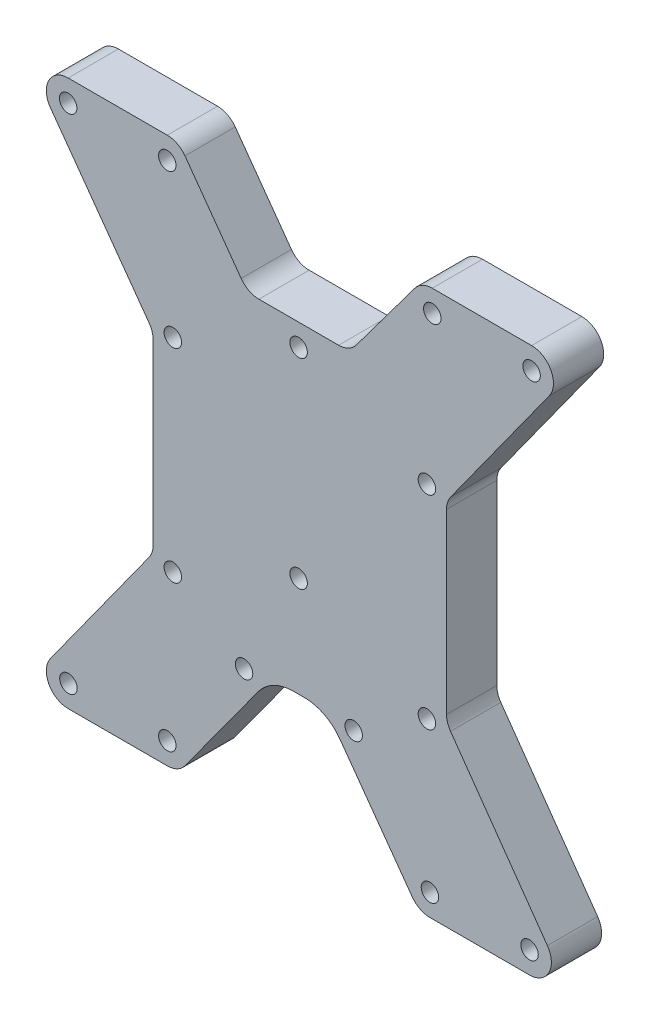
from build123d import *

# Parameters (mm, degrees)
ESQUISSE1_R             = 2
BOSS_EXTRU_1_DEPTH      = 20
BOSS_EXTRU_1_2_DEPTH    = 20
ESQUISSE1_R_2           = 1.874692251
ESQUISSE1_R_3           = 2.114769536
ESQUISSE1_R_4           = 1.974337249
ESQUISSE1_R_5           = 1.950118469
ESQUISSE1_R_6           = 2.076355312
ESQUISSE1_R_7           = 2.221970672
ESQUISSE1_R_8           = 1.90604453
BOSS_EXTRU_1_3_DEPTH    = 20
BOSS_EXTRU_2_DEPTH      = 3
ENL_V_START             = -3
ESQUISSE3_R             = 2
ESQUISSE3_R_2           = 1.90604453
ESQUISSE3_R_3           = 1.874692251
ESQUISSE3_R_4           = 2.114769536
ESQUISSE3_R_5           = 2.076355312
ESQUISSE3_R_6           = 2.221970672
ESQUISSE3_R_7           = 1.950118469
ESQUISSE3_R_8           = 1.974337249
ENL_V_MAT_EXTRU_1_DEPTH = 3
ESQUISSE5_R             = 4
ENL_V_MAT_EXTRU_2_DEPTH = 15
BOSS_EXTRU_6_START      = 10
BOSS_EXTRU_6_DEPTH      = 10


with BuildPart() as part:
    # Esquisse1 → Boss.-Extru.1 (new body)
    with BuildSketch(Plane.XY):
        with BuildLine():
            Line((-12.618276583, 25.9), (12.60601399, 25.9))
            ThreePointArc((12.60601399, 25.9), (8.484252591, 30.605859035), (6.074382869, 36.378774607))
            ThreePointArc((6.074382869, 36.378774607), (0, 39.9), (-6.074382869, 36.378774607))
            ThreePointArc((-6.074382869, 36.378774607), (-8.506971248, 30.615216027), (-12.618276583, 25.9))
        make_face()
        with Locations((0, 32.9)):
            Circle(ESQUISSE1_R, mode=Mode.SUBTRACT)
    extrude(amount=BOSS_EXTRU_1_DEPTH)



with BuildPart() as body_2:
    # Esquisse1 → Boss.-Extru.1 2 (new body)
    with BuildSketch(Plane.XY):
        with BuildLine():
            Line((2.654185885, -10.017862175), (-2.311787947, -10.017862175))
            ThreePointArc((-2.311787947, -10.017862175), (-3.342840598, -10.040984005), (-4.37182022, -10.110303007))
            ThreePointArc((-4.37182022, -10.110303007), (-9.899398478, -11.305465567), (-14.96824135, -13.813326584))
            ThreePointArc((-14.96824135, -13.813326584), (-17.22060215, -8.68083268), (-21.967207188, -5.7))
            Line((-21.967207188, -5.7), (-26.916713164, -5.7))
            ThreePointArc((-26.916713164, -5.7), (-33.497831038, -11.919356094), (-31.915503509, -20.834945939))
            ThreePointArc((-31.915503509, -20.834945939), (-29.076568093, -25.648377222), (-29.441804446, -31.224691186))
            Line((-29.441804446, -31.224691186), (-48.33551387, -57.219681091))
            ThreePointArc((-48.33551387, -57.219681091), (-52.350310177, -57.311139571), (-56.059284304, -55.771508132))
            ThreePointArc((-56.059284304, -55.771508132), (-63.290765435, -55.324955296), (-67.094106026, -61.491666667))
            ThreePointArc((-67.094106026, -61.491666667), (-66.815352866, -65.113322107), (-68.149848832, -68.491666667))
            Line((-68.149848832, -68.491666667), (-68.149848832, -71.491666667))
            Line((-68.149848832, -71.491666667), (-60.094106026, -71.491666667))
            ThreePointArc((-60.094106026, -71.491666667), (-55.55501347, -70.402145821), (-52.005008106, -67.37099442))
            Line((-52.005008106, -67.37099442), (-18.489983788, -21.259206667))
            ThreePointArc((-18.489983788, -21.259206667), (-12.296910299, -15.688773), (-4.37182022, -13.124238397))
            ThreePointArc((-4.37182022, -13.124238397), (-3.343176437, -13.044473935), (-2.311787947, -13.017862175))
            Line((-2.311787947, -13.017862175), (2.654185885, -13.017862175))
            ThreePointArc((2.654185885, -13.017862175), (3.767745611, -13.048886619), (4.87785058, -13.141863701))
            ThreePointArc((4.87785058, -13.141863701), (12.749204669, -15.752561837), (18.884872714, -21.331767658))
            Line((18.884872714, -21.331767658), (52.006994026, -67.334713925))
            ThreePointArc((52.006994026, -67.334713925), (55.563306435, -70.391960836), (60.122337441, -71.491666667))
            Line((60.122337441, -71.491666667), (71.236181886, -71.491666667))
            Line((71.236181886, -71.491666667), (71.236181886, -68.491666667))
            Line((71.236181886, -68.491666667), (71.09992357, -68.491666667))
            ThreePointArc((71.09992357, -68.491666667), (68.064909876, -65.586157047), (67.122337441, -61.491666667))
            ThreePointArc((67.122337441, -61.491666667), (63.633526727, -55.435962761), (56.644751785, -55.416603045))
            ThreePointArc((56.644751785, -55.416603045), (52.423917568, -56.89180534), (47.963309043, -56.584177514))
            Line((47.963309043, -56.584177514), (29.320038148, -30.690745717))
            ThreePointArc((29.320038148, -30.690745717), (30.228551236, -25.172272486), (32.84662865, -20.230146072))
            ThreePointArc((32.84662865, -20.230146072), (33.960030671, -11.490301016), (27.319475738, -5.7))
            Line((27.319475738, -5.7), (23.109581013, -5.7))
            ThreePointArc((23.109581013, -5.7), (18.088025153, -8.753702797), (15.878062286, -14.19954416))
            ThreePointArc((15.878062286, -14.19954416), (10.642043612, -11.449502735), (4.87785058, -10.125607692))
            ThreePointArc((4.87785058, -10.125607692), (3.767322643, -10.044814346), (2.654185885, -10.017862175))
        make_face()
        with Locations((-60.094106026, -61.491666667)):
            Circle(ESQUISSE1_R, mode=Mode.SUBTRACT)
        with Locations((60.122337441, -61.491666667)):
            Circle(ESQUISSE1_R, mode=Mode.SUBTRACT)
        with Locations((-24.979248711, -15.438514977)):
            Circle(ESQUISSE1_R, mode=Mode.SUBTRACT)
        with Locations((25.214528375, -14.817021081)):
            Circle(ESQUISSE1_R, mode=Mode.SUBTRACT)
    extrude(amount=BOSS_EXTRU_1_2_DEPTH)


with BuildPart() as body_3:
    # Esquisse1 → Boss.-Extru.1 3 (new body)
    with BuildSketch(Plane.XY):
        with BuildLine():
            Line((98.695206273, -68.491666667), (98.695206273, -71.491666667))
            Line((98.695206273, -71.491666667), (105.695206273, -71.491666667))
            ThreePointArc((105.695206273, -71.491666667), (114.574610374, -66.091251737), (113.86352118, -55.72290323))
            Line((113.86352118, -55.72290323), (69.552217021, 7.019951504))
            ThreePointArc((69.552217021, 7.019951504), (68.189447281, 9.762425882), (67.720531927, 12.788714941))
            Line((67.720531927, 12.788714941), (67.720531927, 94.127663598))
            ThreePointArc((67.720531927, 94.127663598), (68.203564052, 97.198058112), (69.605996421, 99.971832788))
            Line((69.605996421, 99.971832788), (114.751095568, 162.655081347))
            ThreePointArc((114.751095568, 162.655081347), (115.537169364, 173.057666276), (106.636560061, 178.499250537))
            Line((106.636560061, 178.499250537), (61.180006109, 178.499250537))
            ThreePointArc((61.180006109, 178.499250537), (56.695159764, 177.437155955), (53.162979619, 174.476481188))
            Line((53.162979619, 174.476481188), (26.339854767, 138.499669349))
            ThreePointArc((26.339854767, 138.499669349), (22.807674623, 135.538994582), (18.322828278, 134.4769))
            Line((18.322828278, 134.4769), (-18.17503056, 134.4769))
            ThreePointArc((-18.17503056, 134.4769), (-22.734061565, 135.576605831), (-26.290373974, 138.633852742))
            Line((-26.290373974, 138.633852742), (-52.006994026, 174.351380592))
            ThreePointArc((-52.006994026, 174.351380592), (-55.563306435, 177.408627502), (-60.122337441, 178.508333333))
            Line((-60.122337441, 178.508333333), (-105.477662559, 178.508333333))
            ThreePointArc((-105.477662559, 178.508333333), (-114.377956728, 173.067364339), (-113.593005974, 162.665286075))
            Line((-113.593005974, 162.665286075), (-68.454184001, 99.972477779))
            ThreePointArc((-68.454184001, 99.972477779), (-67.052347315, 97.199167143), (-66.569527415, 94.129430521))
            Line((-66.569527415, 94.129430521), (-66.569527415, 12.864342434))
            ThreePointArc((-66.569527415, 12.864342434), (-67.052559541, 9.79394792), (-68.454991909, 7.020173244))
            Line((-68.454991909, 7.020173244), (-113.588871742, -55.647497477))
            ThreePointArc((-113.588871742, -55.647497477), (-114.374945538, -66.050082406), (-105.474336235, -71.491666667))
            Line((-105.474336235, -71.491666667), (-94.680170737, -71.491666667))
            Line((-94.680170737, -71.491666667), (-94.680170737, -68.491666667))
            ThreePointArc((-94.680170737, -68.491666667), (-97.729924071, -65.597220121), (-98.292420448, -61.430397107))
            ThreePointArc((-98.292420448, -61.430397107), (-99.041391397, -58.265285423), (-101.129444143, -55.771508132))
            ThreePointArc((-101.129444143, -55.771508132), (-104.226059135, -53.074801839), (-105.158884228, -49.075916171))
            Line((-105.158884228, -49.075916171), (-70.112797393, -0.414984782))
            ThreePointArc((-70.112797393, -0.414984782), (-64.112567226, 0.199943228), (-58.108082899, -0.371954048))
            ThreePointArc((-58.108082899, -0.371954048), (-50.824838318, 4.734020313), (-54.431737482, 12.864635557))
            ThreePointArc((-54.431737482, 12.864635557), (-59.321069137, 14.83567737), (-63.569527415, 17.956762455))
            Line((-63.569527415, 17.956762455), (-63.569527415, 86.308478509))
            ThreePointArc((-63.569527415, 86.308478509), (-59.005626968, 90.664165622), (-53.581097924, 93.885296196))
            ThreePointArc((-53.581097924, 93.885296196), (-50.797986053, 101.411659089), (-56.913487983, 106.607088448))
            ThreePointArc((-56.913487983, 106.607088448), (-63.551216708, 106.38316426), (-70.112797393, 107.410414757))
            Line((-70.112797393, 107.410414757), (-106.455589949, 157.886515529))
            ThreePointArc((-106.455589949, 157.886515529), (-104.939524468, 160.636094627), (-102.268813102, 162.287136892))
            ThreePointArc((-102.268813102, 162.287136892), (-99.500123509, 164.865665781), (-98.477662559, 168.508333333))
            ThreePointArc((-98.477662559, 168.508333333), (-98.469243458, 172.314208329), (-96.399866541, 175.508333333))
            Line((-96.399866541, 175.508333333), (-68.539126979, 175.508333333))
            ThreePointArc((-68.539126979, 175.508333333), (-66.933106758, 172.96136633), (-66.972148864, 169.950582781))
            ThreePointArc((-66.972148864, 169.950582781), (-64.364536367, 162.940232376), (-56.913487983, 162.287136892))
            ThreePointArc((-56.913487983, 162.287136892), (-53.252676787, 164.541222985), (-48.979422053, 165.01211225))
            Line((-48.979422053, 165.01211225), (-28.724976998, 136.880938564))
            ThreePointArc((-28.724976998, 136.880938564), (-24.101770867, 132.906517581), (-18.17503056, 131.4769))
            Line((-18.17503056, 131.4769), (-11.549018405, 131.4769))
            ThreePointArc((-11.549018405, 131.4769), (-8.118700434, 127.543990382), (-6.719815945, 122.516269065))
            ThreePointArc((-6.719815945, 122.516269065), (0, 117.4769), (6.719815945, 122.516269065))
            ThreePointArc((6.719815945, 122.516269065), (8.154764996, 127.987281447), (12.60601399, 131.4769))
            Line((12.60601399, 131.4769), (18.322828278, 131.4769))
            ThreePointArc((18.322828278, 131.4769), (24.153128527, 132.857622957), (28.744962714, 136.706500153))
            Line((28.744962714, 136.706500153), (50.492305948, 165.875363954))
            ThreePointArc((50.492305948, 165.875363954), (53.950241092, 165.388407059), (56.644751785, 163.167133863))
            ThreePointArc((56.644751785, 163.167133863), (64.117115209, 162.145244703), (68.180006109, 168.499250537))
            ThreePointArc((68.180006109, 168.499250537), (68.943834191, 172.463697817), (71.605731119, 175.499250537))
            Line((71.605731119, 175.499250537), (97.785319131, 175.499250537))
            ThreePointArc((97.785319131, 175.499250537), (99.633870661, 172.243331646), (99.636560061, 168.499250537))
            ThreePointArc((99.636560061, 168.499250537), (100.555713544, 165.031786674), (103.071790243, 162.474931808))
            ThreePointArc((103.071790243, 162.474931808), (105.452188558, 160.047199302), (106.992924037, 157.016305796))
            Line((106.992924037, 157.016305796), (70.709893777, 106.637898232))
            ThreePointArc((70.709893777, 106.637898232), (64.715212852, 105.801442963), (58.720531927, 106.637898232))
            ThreePointArc((58.720531927, 106.637898232), (52.039655703, 101.727370145), (54.732102436, 93.885296196))
            ThreePointArc((54.732102436, 93.885296196), (60.102561048, 90.592885208), (64.720531927, 86.308478509))
            Line((64.720531927, 86.308478509), (64.720531927, 17.956762455))
            ThreePointArc((64.720531927, 17.956762455), (61.559771385, 14.926465023), (57.424671579, 13.486305546))
            ThreePointArc((57.424671579, 13.486305546), (51.979025462, 4.722598847), (61.180006109, 0.053597684))
            ThreePointArc((61.180006109, 0.053597684), (66.188988663, 0.983602476), (71.09992357, -0.371954048))
            Line((71.09992357, -0.371954048), (107.780880387, -52.310573069))
            ThreePointArc((107.780880387, -52.310573069), (105.967249297, -53.831784364), (103.788178625, -54.756442428))
            ThreePointArc((103.788178625, -54.756442428), (100.068668324, -57.23704927), (98.695206273, -61.491666666))
            ThreePointArc((98.695206273, -61.491666666), (99.676425465, -64.991666666), (98.695206273, -68.491666667))
        make_face()
        with Locations((58.720531927, 99.637898232)):
            Circle(ESQUISSE1_R, mode=Mode.SUBTRACT)
        with Locations((106.636560061, 168.499250537)):
            Circle(ESQUISSE1_R_2, mode=Mode.SUBTRACT)
        with Locations((61.180006109, 168.499250537)):
            Circle(ESQUISSE1_R_3, mode=Mode.SUBTRACT)
        with Locations((-105.477662559, 168.508333333)):
            Circle(ESQUISSE1_R_4, mode=Mode.SUBTRACT)
        with Locations((-60.122337441, 168.508333333)):
            Circle(ESQUISSE1_R_5, mode=Mode.SUBTRACT)
        with Locations((0, 124.4769)):
            Circle(ESQUISSE1_R_6, mode=Mode.SUBTRACT)
        with Locations((-57.569527415, 99.637898232)):
            Circle(ESQUISSE1_R_7, mode=Mode.SUBTRACT)
        with Locations((58.720531927, 6.607297917)):
            Circle(ESQUISSE1_R, mode=Mode.SUBTRACT)
        with Locations((-57.569527415, 6.607297917)):
            Circle(ESQUISSE1_R_8, mode=Mode.SUBTRACT)
        with Locations((-105.354703353, -61.430397107)):
            Circle(ESQUISSE1_R, mode=Mode.SUBTRACT)
        with Locations((105.695206273, -61.491666667)):
            Circle(ESQUISSE1_R, mode=Mode.SUBTRACT)
    extrude(amount=BOSS_EXTRU_1_3_DEPTH)


with BuildPart() as part_1:
    add(part.part)

    add(body_2.part)  # Boss.-Extru.2 merges body 2

    add(body_3.part)  # Boss.-Extru.2 merges body 3
    # Esquisse2 → Boss.-Extru.2 (add)
    with BuildSketch(Plane.XY.offset(20)):
        with BuildLine():
            Line((-113.593005974, 162.665286075), (-68.454184001, 99.972477779))
            ThreePointArc((-68.454184001, 99.972477779), (-67.052347315, 97.199167143), (-66.569527415, 94.129430521))
            Line((-66.569527415, 94.129430521), (-66.569527415, 12.864342434))
            ThreePointArc((-66.569527415, 12.864342434), (-67.052559541, 9.79394792), (-68.454991909, 7.020173244))
            Line((-68.454991909, 7.020173244), (-113.588871742, -55.647497477))
            ThreePointArc((-113.588871742, -55.647497477), (-114.374945538, -66.050082406), (-105.474336235, -71.491666667))
            Line((-105.474336235, -71.491666667), (-94.680170737, -71.491666667))
            Line((-94.680170737, -71.491666667), (-68.149848832, -71.491666667))
            Line((-68.149848832, -71.491666667), (-60.094106026, -71.491666667))
            ThreePointArc((-60.094106026, -71.491666667), (-55.55501347, -70.402145821), (-52.005008106, -67.37099442))
            Line((-52.005008106, -67.37099442), (-18.489983788, -21.259206667))
            ThreePointArc((-18.489983788, -21.259206667), (-11.389973059, -15.196903865), (-2.311787947, -13.017862175))
            Line((-2.311787947, -13.017862175), (2.654185885, -13.017862175))
            ThreePointArc((2.654185885, -13.017862175), (11.772247895, -15.217273837), (18.884872714, -21.331767658))
            Line((18.884872714, -21.331767658), (52.006994026, -67.334713925))
            ThreePointArc((52.006994026, -67.334713925), (55.563306435, -70.391960836), (60.122337441, -71.491666667))
            Line((60.122337441, -71.491666667), (71.236181886, -71.491666667))
            Line((71.236181886, -71.491666667), (98.695206273, -71.491666667))
            Line((98.695206273, -71.491666667), (105.695206273, -71.491666667))
            ThreePointArc((105.695206273, -71.491666667), (114.574610374, -66.091251737), (113.86352118, -55.72290323))
            Line((113.86352118, -55.72290323), (69.552217021, 7.019951504))
            ThreePointArc((69.552217021, 7.019951504), (68.189447281, 9.762425882), (67.720531927, 12.788714941))
            Line((67.720531927, 12.788714941), (67.720531927, 94.127663598))
            ThreePointArc((67.720531927, 94.127663598), (68.203564052, 97.198058112), (69.605996421, 99.971832788))
            Line((69.605996421, 99.971832788), (114.751095568, 162.655081347))
            ThreePointArc((114.751095568, 162.655081347), (115.537169364, 173.057666276), (106.636560061, 178.499250537))
            Line((106.636560061, 178.499250537), (61.180006109, 178.499250537))
            ThreePointArc((61.180006109, 178.499250537), (56.695159764, 177.437155955), (53.162979619, 174.476481188))
            Line((53.162979619, 174.476481188), (26.339854767, 138.499669349))
            ThreePointArc((26.339854767, 138.499669349), (22.807674623, 135.538994582), (18.322828278, 134.4769))
            Line((18.322828278, 134.4769), (-18.17503056, 134.4769))
            ThreePointArc((-18.17503056, 134.4769), (-22.734061565, 135.576605831), (-26.290373974, 138.633852742))
            Line((-26.290373974, 138.633852742), (-52.006994026, 174.351380592))
            ThreePointArc((-52.006994026, 174.351380592), (-55.563306435, 177.408627502), (-60.122337441, 178.508333333))
            Line((-60.122337441, 178.508333333), (-105.477662559, 178.508333333))
            ThreePointArc((-105.477662559, 178.508333333), (-114.377956728, 173.067364339), (-113.593005974, 162.665286075))
        make_face()
    extrude(amount=BOSS_EXTRU_2_DEPTH)

    # Esquisse3 → Enlèv. mat.-Extru.1 (cut)
    with BuildSketch(Plane.XY.offset(23).offset(ENL_V_START)):
        with Locations((58.720531927, 99.637898232)):
            Circle(ESQUISSE3_R)
        with Locations((-105.354703353, -61.430397107)):
            Circle(ESQUISSE3_R)
        with Locations((-60.094106026, -61.491666667)):
            Circle(ESQUISSE3_R)
        with Locations((105.695206273, -61.491666667)):
            Circle(ESQUISSE3_R)
        with Locations((60.122337441, -61.491666667)):
            Circle(ESQUISSE3_R)
        with Locations((25.214528375, -14.817021081)):
            Circle(ESQUISSE3_R)
        with Locations((-24.979248711, -15.438514977)):
            Circle(ESQUISSE3_R)
        with Locations((-57.569527415, 6.607297917)):
            Circle(ESQUISSE3_R_2)
        with Locations((0, 32.9)):
            Circle(ESQUISSE3_R)
        with Locations((58.720531927, 6.607297917)):
            Circle(ESQUISSE3_R)
        with Locations((106.636560061, 168.499250537)):
            Circle(ESQUISSE3_R_3)
        with Locations((61.180006109, 168.499250537)):
            Circle(ESQUISSE3_R_4)
        with Locations((0, 124.4769)):
            Circle(ESQUISSE3_R_5)
        with Locations((-57.569527415, 99.637898232)):
            Circle(ESQUISSE3_R_6)
        with Locations((-60.122337441, 168.508333333)):
            Circle(ESQUISSE3_R_7)
        with Locations((-105.477662559, 168.508333333)):
            Circle(ESQUISSE3_R_8)
    extrude(amount=ENL_V_MAT_EXTRU_1_DEPTH, mode=Mode.SUBTRACT)

    # Esquisse5 → Enlèv. mat.-Extru.2 (cut)
    with BuildSketch(Plane.XY.offset(23)):
        with Locations((-105.477662559, 168.508333333)):
            Circle(ESQUISSE5_R)
        with Locations((-60.122337441, 168.508333333)):
            Circle(ESQUISSE5_R)
        with Locations((0, 124.4769)):
            Circle(ESQUISSE5_R)
        with Locations((-57.569527415, 99.637898232)):
            Circle(ESQUISSE5_R)
        with Locations((61.180006109, 168.499250537)):
            Circle(ESQUISSE5_R)
        with Locations((106.636560061, 168.499250537)):
            Circle(ESQUISSE5_R)
        with Locations((58.720531927, 99.637898232)):
            Circle(ESQUISSE5_R)
        with Locations((0, 32.9)):
            Circle(ESQUISSE5_R)
        with Locations((-57.569527415, 6.607297917)):
            Circle(ESQUISSE5_R)
        with Locations((58.720531927, 6.607297917)):
            Circle(ESQUISSE5_R)
        with Locations((-24.979248711, -15.438514977)):
            Circle(ESQUISSE5_R)
        with Locations((25.214528375, -14.817021081)):
            Circle(ESQUISSE5_R)
        with Locations((60.122337441, -61.491666667)):
            Circle(ESQUISSE5_R)
        with Locations((105.695206273, -61.491666667)):
            Circle(ESQUISSE5_R)
        with Locations((-60.094106026, -61.491666667)):
            Circle(ESQUISSE5_R)
        with Locations((-105.354703353, -61.430397107)):
            Circle(ESQUISSE5_R)
    extrude(amount=-ENL_V_MAT_EXTRU_2_DEPTH, mode=Mode.SUBTRACT)

    # Esquisse6 → Boss.-Extru.6 (add)
    with BuildSketch(Plane(origin=(0, 0, 20), x_dir=(-1, 0, 0), z_dir=(0, 0, -1)).offset(BOSS_EXTRU_6_START)):
        with BuildLine():
            ThreePointArc((-6.719815945, 122.516269065), (-2.68800819, 79.475314265), (-6.074382869, 36.378774607))
            ThreePointArc((-6.074382869, 36.378774607), (0, 39.9), (6.074382869, 36.378774607))
            ThreePointArc((6.074382869, 36.378774607), (2.716887155, 79.475097873), (6.719815945, 122.516269065))
            ThreePointArc((6.719815945, 122.516269065), (0, 117.4769), (-6.719815945, 122.516269065))
        make_face()
        with BuildLine():
            ThreePointArc((20.909977521, -7.050634762), (35.923020028, 5.848993516), (54.431737482, 12.864635557))
            ThreePointArc((54.431737482, 12.864635557), (50.757722828, 4.995057779), (57.569527415, -0.392702083))
            ThreePointArc((57.569527415, -0.392702083), (44.15125386, -6.29105799), (33.813063689, -16.681558055))
            ThreePointArc((33.813063689, -16.681558055), (30.007713784, -8.320843522), (20.909977521, -7.050634762))
        make_face()
        with BuildLine():
            ThreePointArc((-54.747712597, 12.104380622), (-38.118816039, 4.641248084), (-23.109581013, -5.7))
            ThreePointArc((-23.109581013, -5.7), (-31.30169525, -10.075924998), (-32.922270094, -19.221043502))
            ThreePointArc((-32.922270094, -19.221043502), (-44.340294431, -7.423977526), (-58.983607002, 0))
            ThreePointArc((-58.983607002, 0), (-52.909012411, 4.667572538), (-54.747712597, 12.104380622))
        make_face()
    extrude(amount=-BOSS_EXTRU_6_DEPTH)


solid = part_1.part
